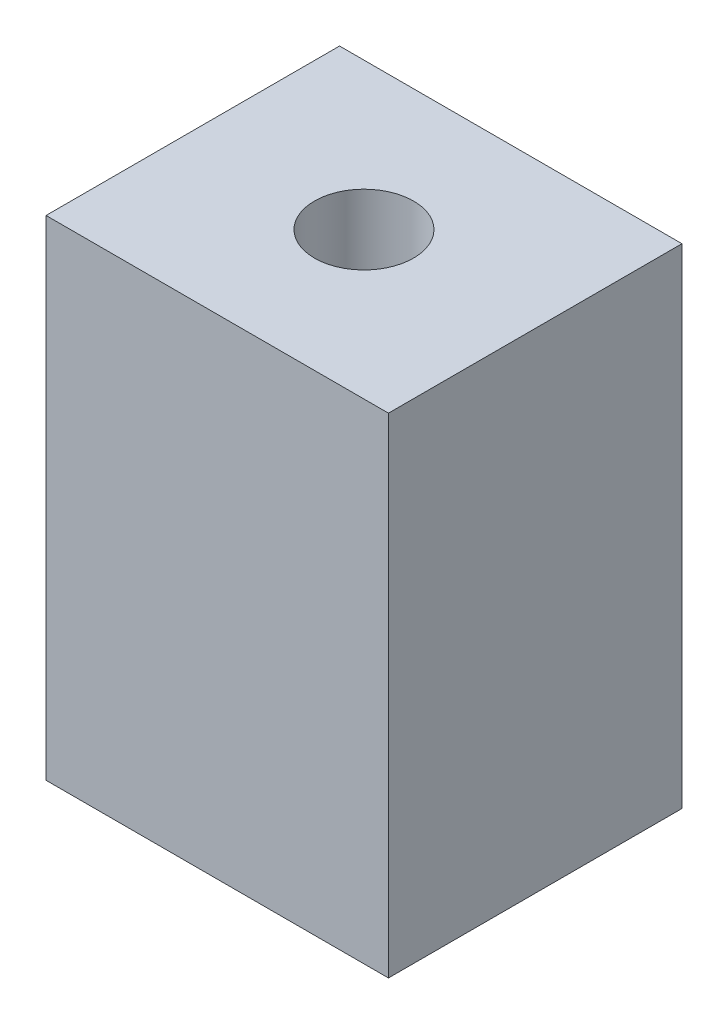
from build123d import *

# Parameters (mm, degrees)
SKETCH1_W           = 35
SKETCH1_H           = 30
BOSS_EXTRUDE1_DEPTH = 50
SKETCH3_R           = 5.060672104
CUT_EXTRUDE1_DEPTH  = 40


with BuildPart() as part:
    # Sketch1 → Boss-Extrude1 (new body)
    with BuildSketch(Plane(origin=(0, 0, 0), x_dir=(1, 0, 0), z_dir=(0, 1, 0))):
        with Locations((19.244566665, 5.351894021)):
            Rectangle(SKETCH1_W, SKETCH1_H)
    extrude(amount=BOSS_EXTRUDE1_DEPTH)

    # Sketch3 → Cut-Extrude1 (cut)
    with BuildSketch(Plane(origin=(0, 50, 0), x_dir=(1, 0, 0), z_dir=(0, 1, 0))):
        with Locations(Location((19.244566665, 5.351894021, 0), (0, 0, 270))):
            Circle(SKETCH3_R)
    extrude(amount=-CUT_EXTRUDE1_DEPTH, mode=Mode.SUBTRACT)


solid = part.part
